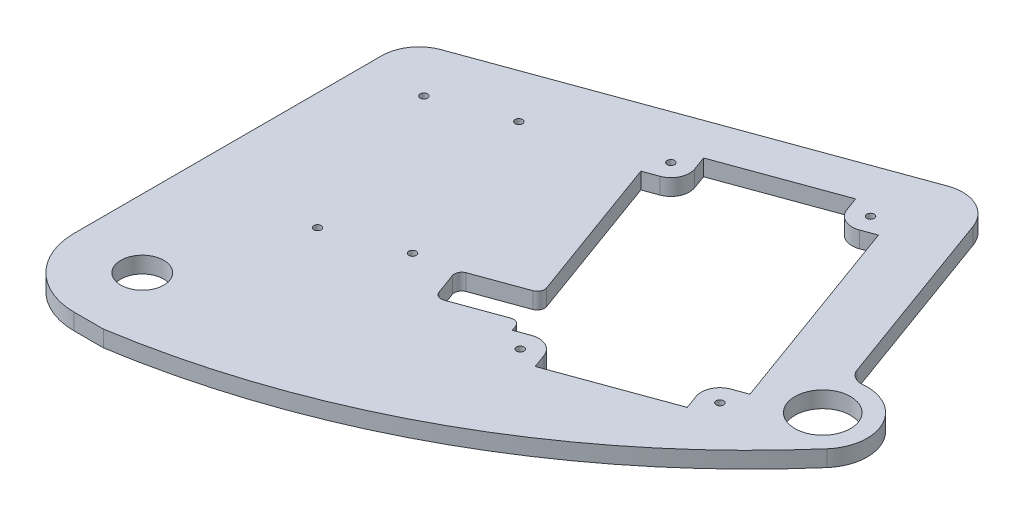
from build123d import *

# Parameters (mm, degrees)
SKETCH1_R               = 7.366
SKETCH1_R_2             = 9.525
BOSS_EXTRUDE1_DEPTH     = 5.588
CUT_EXTRUDE1_DEPTH      = 334.830246753
CUT_EXTRUDE1_DEPTH_BACK = 334.830246753
SKETCH2_R               = 1.27
FILLET1_R               = 12.7
FILLET2_R               = 5.08
CUT_EXTRUDE3_DEPTH      = 334.830246753
CUT_EXTRUDE4_DEPTH      = 334.830246753
FILLET3_R               = 2.54
SKETCH6_R               = 1.27
CUT_EXTRUDE5_DEPTH      = 334.830246753


with BuildPart() as part:
    # Sketch1 → Boss-Extrude1 (new body)
    with BuildSketch(Plane(origin=(0, 0, 0), x_dir=(1, 0, 0), z_dir=(0, 1, 0))):
        with BuildLine():
            Line((8.382, -240.03), (8.382, -125.73))
            Line((8.382, -125.73), (155.947491633, -72.020553441))
            Line((155.947491633, -72.020553441), (184.566884059, -150.651687889))
            ThreePointArc((184.566884059, -150.651687889), (202.338954157, -156.340572379), (201.281045045, -174.970943032))
            ThreePointArc((201.281045045, -174.970943032), (129.350312262, -233.232473549), (41.837585925, -263.398))
            Line((41.837585925, -263.398), (31.75, -263.398))
            ThreePointArc((31.75, -263.398), (15.226328737, -256.553671263), (8.382, -240.03))
        make_face()
        with Locations(Location((31.75, -240.03, 0), (0, 0, 270))):
            Circle(SKETCH1_R, mode=Mode.SUBTRACT)
        with Locations(Location((189.779271043, -164.97260343, 0), (0, 0, 270))):
            Circle(SKETCH1_R_2, mode=Mode.SUBTRACT)
    extrude(amount=BOSS_EXTRUDE1_DEPTH)

    # Sketch2 → Cut-Extrude1 (cut, two sides: drawn at the far end of the back side and taken through both)
    with BuildSketch(Plane(origin=(0, 5.588, 0), x_dir=(1, 0, 0), z_dir=(0, 1, 0)).offset(-CUT_EXTRUDE1_DEPTH_BACK)):
        with Locations(Location((169.269931238, -179.701578394, 0), (0, 0, 270))):
            Circle(SKETCH2_R)
        with Locations(Location((119.146726846, -197.944932839, 0), (0, 0, 270))):
            Circle(SKETCH2_R)
        with Locations(Location((89.609867268, -116.793078108, 0), (0, 0, 270))):
            Circle(SKETCH2_R)
        with Locations(Location((139.733071661, -98.549723663, 0), (0, 0, 270))):
            Circle(SKETCH2_R)
    extrude(amount=CUT_EXTRUDE1_DEPTH + CUT_EXTRUDE1_DEPTH_BACK, mode=Mode.SUBTRACT)

    # Fillet1
    fillet1_edges = [part.edges().sort_by_distance(p)[0] for p in [
        (155.947491633, 2.794, 72.020553441),
        (8.382, 2.794, 125.73),
    ]]
    fillet(fillet1_edges, radius=FILLET1_R)

    # Fillet2
    fillet2_edges = [part.edges().sort_by_distance(p)[0] for p in [
        (184.566884059, 2.794, 150.651687889),
    ]]
    fillet(fillet2_edges, radius=FILLET2_R)

    # Sketch4 → Cut-Extrude3 (cut, through all)
    with BuildSketch(Plane(origin=(0, 5.588, 0), x_dir=(1, 0, 0), z_dir=(0, 1, 0))):
        with BuildLine():
            Line((95.57691541, -114.621250198), (93.839453082, -109.847611684))
            Line((93.839453082, -109.847611684), (132.028561191, -95.947913059))
            Line((132.028561191, -95.947913059), (133.766023519, -100.721551573))
            ThreePointArc((133.766023519, -100.721551573), (137.049445699, -104.304778111), (141.904899571, -104.516771805))
            Line((141.904899571, -104.516771805), (146.678538084, -102.779309477))
            Line((146.678538084, -102.779309477), (171.871741842, -171.997067924))
            Line((171.871741842, -171.997067924), (167.098103328, -173.734530252))
            ThreePointArc((167.098103328, -173.734530252), (163.514876791, -177.017952432), (163.302883096, -181.873406304))
            Line((163.302883096, -181.873406304), (165.040345424, -186.647044818))
            Line((165.040345424, -186.647044818), (126.851237316, -200.546743442))
            Line((126.851237316, -200.546743442), (125.113774988, -195.773104929))
            ThreePointArc((125.113774988, -195.773104929), (121.830352808, -192.189878391), (116.974898936, -191.977884697))
            Line((116.974898936, -191.977884697), (112.201260422, -193.715347025))
            Line((112.201260422, -193.715347025), (87.008056665, -124.497588578))
            Line((87.008056665, -124.497588578), (91.781695178, -122.76012625))
            ThreePointArc((91.781695178, -122.76012625), (95.364921716, -119.47670407), (95.57691541, -114.621250198))
        make_face()
    extrude(amount=-CUT_EXTRUDE3_DEPTH, mode=Mode.SUBTRACT)

    # Sketch5 → Cut-Extrude4 (cut, through all)
    with BuildSketch(Plane(origin=(0, 5.588, 0), x_dir=(1, 0, 0), z_dir=(0, 1, 0))):
        Polygon((110.680980885, -189.538413326), (89.199607574, -197.356993802), (84.855951753, -185.422897518), (106.337325065, -177.604317042), align=None)
    extrude(amount=-CUT_EXTRUDE4_DEPTH, mode=Mode.SUBTRACT)

    # Fillet3
    fillet3_edges = [part.edges().sort_by_distance(p)[0] for p in [
        (106.337325065, 2.794, 177.604317042),
        (110.680980885, 2.794, 189.538413326),
        (89.199607574, 2.794, 197.356993802),
        (84.855951753, 2.794, 185.422897518),
    ]]
    fillet(fillet3_edges, radius=FILLET3_R)

    # Sketch6 → Cut-Extrude5 (cut, through all)
    with BuildSketch(Plane(origin=(0, 5.588, 0), x_dir=(1, 0, 0), z_dir=(0, 1, 0))):
        with Locations(Location((51.420759159, -130.692776733, 0), (0, 0, 270))):
            Circle(SKETCH6_R)
        with Locations(Location((27.552566591, -139.380088373, 0), (0, 0, 270))):
            Circle(SKETCH6_R)
        with Locations(Location((48.402114528, -196.663750536, 0), (0, 0, 270))):
            Circle(SKETCH6_R)
        with Locations(Location((72.270307096, -187.976438896, 0), (0, 0, 270))):
            Circle(SKETCH6_R)
    extrude(amount=-CUT_EXTRUDE5_DEPTH, mode=Mode.SUBTRACT)


solid = part.part
